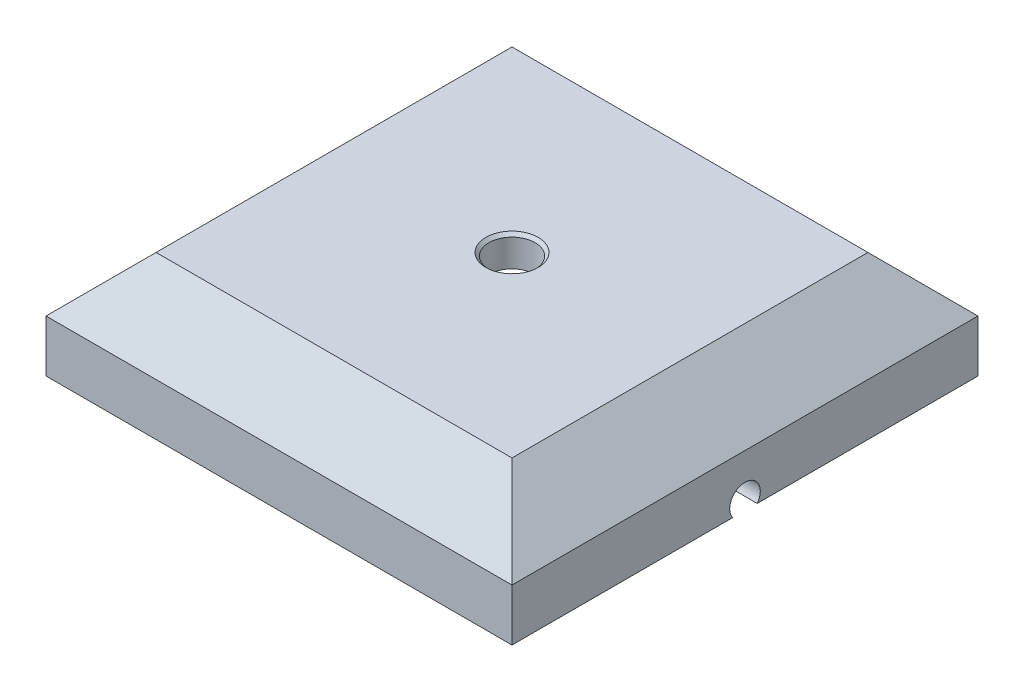
from build123d import *

# Parameters (mm, degrees)
SKETCH1_W               = 152.4
SKETCH1_H               = 152.4
BOSS_EXTRUDE1_DEPTH     = 35
SKETCH2_R               = 7.55
CUT_EXTRUDE1_DEPTH      = 114.304368848
CHAMFER1_SIZE           = 18
CUT_EXTRUDE2_REACH      = 175.946
CUT_EXTRUDE2_END_RADIUS = 7.55
SKETCH4_R               = 5
SKETCH5_W               = 127
SKETCH5_H               = 127
CUT_EXTRUDE3_DEPTH      = 25
CHAMFER3_SIZE           = 1


with BuildPart() as part:
    # Sketch1 → Boss-Extrude1 (new body)
    with BuildSketch(Plane(origin=(0, 0, 0), x_dir=(1, 0, 0), z_dir=(0, 1, 0))):
        Rectangle(SKETCH1_W, SKETCH1_H)
    extrude(amount=BOSS_EXTRUDE1_DEPTH)

    # Sketch2 → Cut-Extrude1 (cut, through all)
    with BuildSketch(Plane(origin=(0, 35, 0), x_dir=(1, 0, 0), z_dir=(0, 1, 0))):
        with Locations(Location((0, 0, 0), (0, 0, 270))):
            Circle(SKETCH2_R)
    extrude(amount=-CUT_EXTRUDE1_DEPTH, mode=Mode.SUBTRACT)

    # Chamfer1
    chamfer1_edges = [part.edges().sort_by_distance(p)[0] for p in [
        (76.2, 35, 0),
        (0, 35, -76.2),
        (-76.2, 35, 0),
        (0, 35, 76.2),
    ]]
    chamfer(chamfer1_edges, length=CHAMFER1_SIZE)

    # Cut-Extrude2: up to this cylinder (the profile starts outside it)
    cut_extrude2_end = Plane(origin=(0, 3, 0), z_dir=(0, 1, 0)) * Cylinder(CUT_EXTRUDE2_END_RADIUS, 367.992, mode=Mode.PRIVATE)
    # Sketch4 → Cut-Extrude2 (cut, up to the surface)
    with BuildSketch(Plane(origin=(76.2, 0, 0), x_dir=(0, 0, -1), z_dir=(1, 0, 0)), mode=Mode.PRIVATE) as cut_extrude2_sk1:
        with Locations((0, 3)):
            Circle(SKETCH4_R)
    cut_extrude2_tool1 = extrude(cut_extrude2_sk1.sketch, amount=-CUT_EXTRUDE2_REACH, mode=Mode.PRIVATE) - cut_extrude2_end
    add(cut_extrude2_tool1.solids().sort_by_distance((76.2, 3, 0))[0], mode=Mode.SUBTRACT)

    # Sketch5 → Cut-Extrude3 (cut)
    with BuildSketch(Plane.XZ):
        Rectangle(SKETCH5_W, SKETCH5_H)
    extrude(amount=-CUT_EXTRUDE3_DEPTH, mode=Mode.SUBTRACT)

    # Chamfer3
    chamfer3_edges = [part.edges().sort_by_distance(p)[0] for p in [
        (0, 35, -7.55),
    ]]
    chamfer(chamfer3_edges, length=CHAMFER3_SIZE)


solid = part.part
